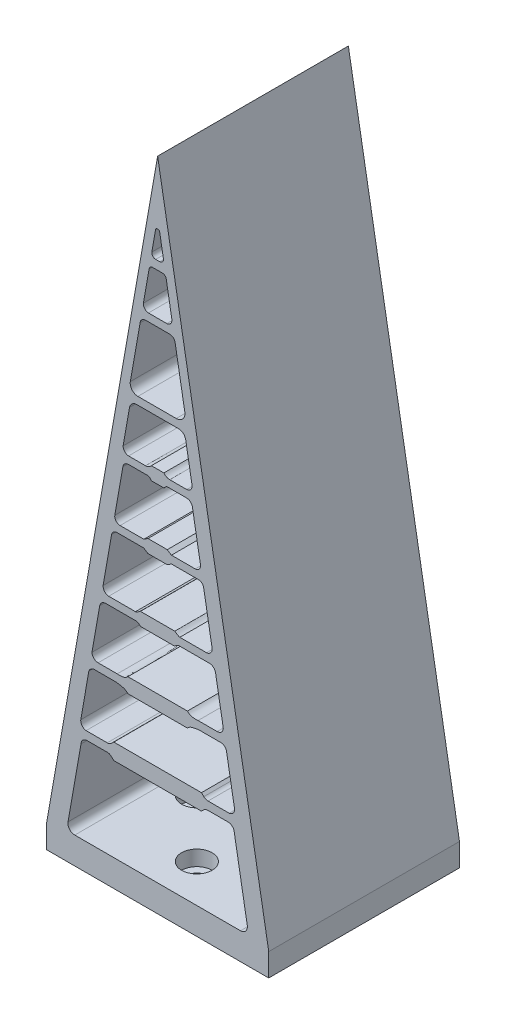
from build123d import *

# Parameters (mm, degrees)
BOSS_EXTRUDE1_DEPTH = 25
CUT_EXTRUDE1_REACH  = 92.769
SKETCH4_R           = 1
CUT_EXTRUDE2_START  = -2
SKETCH5_R           = 2
SKETCH5_R_2         = 1
CUT_EXTRUDE2_DEPTH  = 2


with BuildPart() as part:
    # Sketch2 → Boss-Extrude1 (new body)
    with BuildSketch(Plane.XY):
        Polygon((14.422152343, -46.919584995), (-0.139795688, 36.091209392), (-14.701743719, -46.919584995), (-14.701743719, -49.919584995), (14.422152343, -49.919584995), align=None)
        with BuildLine():
            Line((-1.40400653, -9.655975895), (-0.139795688, -9.655975895))
            Line((-0.139795688, -9.655975895), (1.124415155, -9.655975895))
            Line((1.124415155, -9.655975895), (1.668587786, -9.300465842))
            Line((1.668587786, -9.300465842), (5.204485199, -9.300465842))
            ThreePointArc((5.204485199, -9.300465842), (5.654671752, -9.464432199), (5.893957023, -9.87951708))
            Line((5.893957023, -9.87951708), (7.006215614, -16.219978464))
            ThreePointArc((7.006215614, -16.219978464), (6.818344291, -16.796821256), (6.277609756, -17.07186562))
            Line((6.277609756, -17.07186562), (2.763006949, -17.07186562))
            add(Edge.make_bspline(
                [(2.111160568, -16.708002848), (2.102252973, -16.627378866), (2.349572053, -16.972792726), (2.763006949, -17.07186562)],
                knots=[0, 0, 0, 0, 1, 1, 1, 1], degree=3))
            Line((2.111160568, -16.708002848), (-0.139795688, -16.708002848))
            Line((-0.139795688, -16.708002848), (-2.390751943, -16.708002848))
            add(Edge.make_bspline(
                [(-2.390751943, -16.708002848), (-2.381844348, -16.627378866), (-2.629163428, -16.972792726), (-3.042598325, -17.07186562)],
                knots=[0, 0, 0, 0, 1, 1, 1, 1], degree=3))
            Line((-3.042598325, -17.07186562), (-6.557201131, -17.07186562))
            ThreePointArc((-6.557201131, -17.07186562), (-7.097935667, -16.796821256), (-7.285806989, -16.219978464))
            Line((-7.285806989, -16.219978464), (-6.173548399, -9.87951708))
            ThreePointArc((-6.173548399, -9.87951708), (-5.934263128, -9.464432199), (-5.484076574, -9.300465842))
            Line((-5.484076574, -9.300465842), (-1.948179161, -9.300465842))
            Line((-1.948179161, -9.300465842), (-1.40400653, -9.655975895))
        make_face(mode=Mode.SUBTRACT)
        with BuildLine():
            Line((-5.881614418, -35.391027806), (-0.139795688, -35.391027806))
            Line((-0.139795688, -35.391027806), (5.602023043, -35.391027806))
            Line((5.602023043, -35.391027806), (5.915498941, -35.09635726))
            ThreePointArc((5.915498941, -35.09635726), (6.16778475, -34.926695384), (6.467542836, -34.875917716))
            Line((6.467542836, -34.875917716), (9.098026574, -34.875917716))
            ThreePointArc((9.098026574, -34.875917716), (9.660370794, -35.102679256), (9.908110966, -35.656101902))
            Line((9.908110966, -35.656101902), (11.608903489, -45.351517523))
            ThreePointArc((11.608903489, -45.351517523), (11.411625827, -46.085834358), (10.722439714, -46.407023075))
            Line((10.722439714, -46.407023075), (-0.139795688, -46.407023075))
            Line((-0.139795688, -46.407023075), (-11.002031089, -46.407023075))
            ThreePointArc((-11.002031089, -46.407023075), (-11.691217203, -46.085834358), (-11.888494864, -45.351517523))
            Line((-11.888494864, -45.351517523), (-10.187702341, -35.656101902))
            ThreePointArc((-10.187702341, -35.656101902), (-9.939962169, -35.102679256), (-9.37761795, -34.875917716))
            Line((-9.37761795, -34.875917716), (-6.747134212, -34.875917716))
            ThreePointArc((-6.747134212, -34.875917716), (-6.447376125, -34.926695384), (-6.195090316, -35.09635726))
            Line((-6.195090316, -35.09635726), (-5.881614418, -35.391027806))
        make_face(mode=Mode.SUBTRACT)
        with BuildLine():
            Line((-4.026574464, -26.882064641), (-0.139795688, -26.882064641))
            Line((-0.139795688, -26.882064641), (3.746983088, -26.882064641))
            add(Edge.make_bspline(
                [(3.746983088, -26.882064641), (3.982195465, -26.700138412), (4.018694606, -26.480042162), (5.313455202, -26.331359996)],
                knots=[0, 0, 0, 0, 1, 1, 1, 1], degree=3))
            Line((5.313455202, -26.331359996), (8.256755855, -26.331359996))
            ThreePointArc((8.256755855, -26.331359996), (8.638933457, -26.519249666), (8.875104179, -26.873630304))
            Line((8.875104179, -26.873630304), (9.935345034, -32.917563119))
            ThreePointArc((9.935345034, -32.917563119), (9.772361548, -33.506379767), (9.240757676, -33.807487694))
            Line((9.240757676, -33.807487694), (6.467542836, -33.807487694))
            ThreePointArc((6.467542836, -33.807487694), (6.16778475, -33.756710027), (5.915498941, -33.58704815))
            Line((5.915498941, -33.58704815), (5.602023043, -33.292377604))
            Line((5.602023043, -33.292377604), (-0.139795688, -33.292377604))
            Line((-0.139795688, -33.292377604), (-5.881614418, -33.292377604))
            Line((-5.881614418, -33.292377604), (-6.195090316, -33.58704815))
            ThreePointArc((-6.195090316, -33.58704815), (-6.447376125, -33.756710027), (-6.747134212, -33.807487694))
            Line((-6.747134212, -33.807487694), (-9.520349051, -33.807487694))
            ThreePointArc((-9.520349051, -33.807487694), (-10.051952923, -33.506379767), (-10.214936409, -32.917563119))
            Line((-10.214936409, -32.917563119), (-9.154695555, -26.873630304))
            ThreePointArc((-9.154695555, -26.873630304), (-8.918524832, -26.519249666), (-8.53634723, -26.331359996))
            Line((-8.53634723, -26.331359996), (-5.593046577, -26.331359996))
            add(Edge.make_bspline(
                [(-4.026574464, -26.882064641), (-4.26178684, -26.700138412), (-4.298285981, -26.480042162), (-5.593046577, -26.331359996)],
                knots=[0, 0, 0, 0, 1, 1, 1, 1], degree=3))
        make_face(mode=Mode.SUBTRACT)
        with BuildLine():
            Line((-2.390751943, -18.418428407), (-0.139795688, -18.418428407))
            Line((-0.139795688, -18.418428407), (2.111160568, -18.418428407))
            add(Edge.make_bspline(
                [(2.111160568, -18.418428407), (2.141080572, -18.390479425), (2.396095932, -18.05922236), (2.763006949, -18.080801157)],
                knots=[0, 0, 0, 0, 1, 1, 1, 1], degree=3))
            Line((2.763006949, -18.080801157), (6.701912748, -18.080801157))
            ThreePointArc((6.701912748, -18.080801157), (7.188440024, -18.284395061), (7.448818359, -18.743047861))
            Line((7.448818359, -18.743047861), (8.464574682, -24.533395358))
            ThreePointArc((8.464574682, -24.533395358), (8.226773089, -25.092599736), (7.664637434, -25.323386736))
            Line((7.664637434, -25.323386736), (5.156289374, -25.323386736))
            add(Edge.make_bspline(
                [(3.762050815, -24.947567838), (3.958534995, -25.129434807), (4.149792228, -25.399832964), (5.156289374, -25.323386736)],
                knots=[0, 0, 0, 0, 1, 1, 1, 1], degree=3))
            Line((3.762050815, -24.947567838), (-0.139795688, -24.947567838))
            Line((-0.139795688, -24.947567838), (-4.04164219, -24.947567838))
            add(Edge.make_bspline(
                [(-4.04164219, -24.947567838), (-4.23812637, -25.129434807), (-4.429383603, -25.399832964), (-5.435880749, -25.323386736)],
                knots=[0, 0, 0, 0, 1, 1, 1, 1], degree=3))
            Line((-5.435880749, -25.323386736), (-7.944228809, -25.323386736))
            ThreePointArc((-7.944228809, -25.323386736), (-8.506364465, -25.092599736), (-8.744166058, -24.533395358))
            Line((-8.744166058, -24.533395358), (-7.728409734, -18.743047861))
            ThreePointArc((-7.728409734, -18.743047861), (-7.468031399, -18.284395061), (-6.981504123, -18.080801157))
            Line((-6.981504123, -18.080801157), (-3.042598325, -18.080801157))
            add(Edge.make_bspline(
                [(-2.390751943, -18.418428407), (-2.420671947, -18.390479425), (-2.675687307, -18.05922236), (-3.042598325, -18.080801157)],
                knots=[0, 0, 0, 0, 1, 1, 1, 1], degree=3))
        make_face(mode=Mode.SUBTRACT)
        with BuildLine():
            Line((2.295557974, 7.526297276), (-0.139795688, 7.526297276))
            Line((-0.139795688, 7.526297276), (-2.729443291, 7.526297276))
            ThreePointArc((-2.729443291, 7.526297276), (-3.501604827, 7.886155909), (-3.722633979, 8.708881738))
            Line((-3.722633979, 8.708881738), (-2.442643211, 16.005505118))
            ThreePointArc((-2.442643211, 16.005505118), (-2.186978691, 16.505082884), (-1.652941749, 16.677555594))
            Line((-1.652941749, 16.677555594), (-0.139795688, 16.677555594))
            Line((-0.139795688, 16.677555594), (1.373350374, 16.677555594))
            ThreePointArc((1.373350374, 16.677555594), (1.907387315, 16.505082884), (2.163051835, 16.005505118))
            Line((2.163051835, 16.005505118), (3.443042604, 8.708881738))
            ThreePointArc((3.443042604, 8.708881738), (3.119455265, 7.874859283), (2.295557974, 7.526297276))
        make_face(mode=Mode.SUBTRACT)
        with BuildLine():
            Line((-0.960175082, -1.168175869), (-0.139795688, -1.168175869))
            Line((-0.139795688, -1.168175869), (0.680583707, -1.168175869))
            add(Edge.make_bspline(
                [(0.680583707, -1.168175869), (0.780839874, -1.061394631), (0.918172753, -0.790932941), (1.263062379, -0.813949097)],
                knots=[0, 0, 0, 0, 1, 1, 1, 1], degree=3))
            Line((1.263062379, -0.813949097), (3.668573853, -0.813949097))
            ThreePointArc((3.668573853, -0.813949097), (4.154894201, -0.991076057), (4.413385477, -1.439477331))
            Line((4.413385477, -1.439477331), (5.472943401, -7.47951708))
            ThreePointArc((5.472943401, -7.47951708), (5.31950522, -8.050652396), (4.783471576, -8.300465842))
            Line((4.783471576, -8.300465842), (1.668587786, -8.300465842))
            Line((1.668587786, -8.300465842), (1.124415155, -7.944955789))
            Line((1.124415155, -7.944955789), (-0.139795688, -7.944955789))
            Line((-0.139795688, -7.944955789), (-1.40400653, -7.944955789))
            Line((-1.40400653, -7.944955789), (-1.948179161, -8.300465842))
            Line((-1.948179161, -8.300465842), (-5.063062951, -8.300465842))
            ThreePointArc((-5.063062951, -8.300465842), (-5.599096595, -8.050652396), (-5.752534776, -7.47951708))
            Line((-5.752534776, -7.47951708), (-4.692976852, -1.439477331))
            ThreePointArc((-4.692976852, -1.439477331), (-4.434485577, -0.991076057), (-3.948165228, -0.813949097))
            Line((-3.948165228, -0.813949097), (-1.542653755, -0.813949097))
            add(Edge.make_bspline(
                [(-0.960175082, -1.168175869), (-1.060431249, -1.061394631), (-1.197764128, -0.790932941), (-1.542653755, -0.813949097)],
                knots=[0, 0, 0, 0, 1, 1, 1, 1], degree=3))
        make_face(mode=Mode.SUBTRACT)
        with BuildLine():
            Line((-4.659377612, 0.944060058), (-3.820763657, 5.724602499))
            ThreePointArc((-3.820763657, 5.724602499), (-3.489473886, 6.299286325), (-2.866191894, 6.526297276))
            Line((-2.866191894, 6.526297276), (-0.139795688, 6.526297276))
            Line((-0.139795688, 6.526297276), (-0.12702464, 6.526297276))
            Line((-0.12702464, 6.526297276), (2.731649129, 6.526297276))
            ThreePointArc((2.731649129, 6.526297276), (3.264062496, 6.25434817), (3.541172282, 5.724602499))
            Line((3.541172282, 5.724602499), (4.379786237, 0.944060058))
            ThreePointArc((4.379786237, 0.944060058), (4.190347888, 0.403391978), (3.674551608, 0.154066772))
            Line((3.674551608, 0.154066772), (1.446159281, 0.154066772))
            add(Edge.make_bspline(
                [(0.680583707, 0.541594227), (0.70301896, 0.521510302), (0.957263814, 0.149921668), (1.446159281, 0.154066772)],
                knots=[0, 0, 0, 0, 1, 1, 1, 1], degree=3))
            Line((0.680583707, 0.541594227), (-0.139795688, 0.541594227))
            Line((-0.139795688, 0.541594227), (-0.960175082, 0.541594227))
            add(Edge.make_bspline(
                [(-0.960175082, 0.541594227), (-0.982610335, 0.521510302), (-1.236855189, 0.149921668), (-1.725750656, 0.154066772)],
                knots=[0, 0, 0, 0, 1, 1, 1, 1], degree=3))
            Line((-1.725750656, 0.154066772), (-3.954142983, 0.154066772))
            ThreePointArc((-3.954142983, 0.154066772), (-4.469939263, 0.403391978), (-4.659377612, 0.944060058))
        make_face(mode=Mode.SUBTRACT)
        with BuildLine():
            Line((1.069108247, 17.685824003), (-0.139795688, 17.685824003))
            Line((-0.139795688, 17.685824003), (-1.348699622, 17.685824003))
            ThreePointArc((-1.348699622, 17.685824003), (-1.841673607, 17.938808604), (-2.01094404, 18.466418383))
            Line((-2.01094404, 18.466418383), (-1.264950242, 22.718977013))
            ThreePointArc((-1.264950242, 22.718977013), (-1.094032192, 23.015466214), (-0.772470368, 23.13258504))
            Line((-0.772470368, 23.13258504), (-0.139795688, 23.13258504))
            Line((-0.139795688, 23.13258504), (0.492878992, 23.13258504))
            ThreePointArc((0.492878992, 23.13258504), (0.814440816, 23.015466214), (0.985358867, 22.718977013))
            Line((0.985358867, 22.718977013), (1.731352665, 18.466418383))
            ThreePointArc((1.731352665, 18.466418383), (1.562082232, 17.938808604), (1.069108247, 17.685824003))
        make_face(mode=Mode.SUBTRACT)
        with BuildLine():
            Line((0.123228718, 24.239786827), (-0.139795688, 24.239786827))
            Line((-0.139795688, 24.239786827), (-0.402820093, 24.239786827))
            ThreePointArc((-0.402820093, 24.239786827), (-0.785701267, 24.418225003), (-0.895299968, 24.826178801))
            Line((-0.895299968, 24.826178801), (-0.401243915, 27.642559228))
            ThreePointArc((-0.401243915, 27.642559228), (-0.332876695, 27.761154909), (-0.204251965, 27.808002439))
            Line((-0.204251965, 27.808002439), (-0.139795688, 27.808002439))
            Line((-0.139795688, 27.808002439), (-0.07533941, 27.808002439))
            ThreePointArc((-0.07533941, 27.808002439), (0.05328532, 27.761154909), (0.12165254, 27.642559228))
            Line((0.12165254, 27.642559228), (0.615708593, 24.826178801))
            ThreePointArc((0.615708593, 24.826178801), (0.506109892, 24.418225003), (0.123228718, 24.239786827))
        make_face(mode=Mode.SUBTRACT)
    extrude(amount=BOSS_EXTRUDE1_DEPTH)

    # Sketch4 → Cut-Extrude1 (cut, up to next)
    with BuildSketch(Plane.XZ.offset(49.919584995), mode=Mode.PRIVATE) as cut_extrude1_sk1:
        with Locations(Location((0, 5, 0), (0, 0, 270))):
            Circle(SKETCH4_R)
    cut_extrude1_tool1 = extrude(cut_extrude1_sk1.sketch, amount=-CUT_EXTRUDE1_REACH, mode=Mode.PRIVATE) & part.part
    # Sketch4 → Cut-Extrude1 (cut, up to next)
    with BuildSketch(Plane.XZ.offset(49.919584995), mode=Mode.PRIVATE) as cut_extrude1_sk2:
        with Locations(Location((-7.5, 12.5, 0), (0, 0, 270))):
            Circle(SKETCH4_R)
    cut_extrude1_tool2 = extrude(cut_extrude1_sk2.sketch, amount=-CUT_EXTRUDE1_REACH, mode=Mode.PRIVATE) & part.part
    # Sketch4 → Cut-Extrude1 (cut, up to next)
    with BuildSketch(Plane.XZ.offset(49.919584995), mode=Mode.PRIVATE) as cut_extrude1_sk3:
        with Locations(Location((0, 20, 0), (0, 0, 270))):
            Circle(SKETCH4_R)
    cut_extrude1_tool3 = extrude(cut_extrude1_sk3.sketch, amount=-CUT_EXTRUDE1_REACH, mode=Mode.PRIVATE) & part.part
    # Sketch4 → Cut-Extrude1 (cut, up to next)
    with BuildSketch(Plane.XZ.offset(49.919584995), mode=Mode.PRIVATE) as cut_extrude1_sk4:
        with Locations(Location((7.5, 12.5, 0), (0, 0, 270))):
            Circle(SKETCH4_R)
    cut_extrude1_tool4 = extrude(cut_extrude1_sk4.sketch, amount=-CUT_EXTRUDE1_REACH, mode=Mode.PRIVATE) & part.part
    add(cut_extrude1_tool1.solids().sort_by_distance((0, -49.919585, 5))[0], mode=Mode.SUBTRACT)
    add(cut_extrude1_tool2.solids().sort_by_distance((-7.5, -49.919585, 12.5))[0], mode=Mode.SUBTRACT)
    add(cut_extrude1_tool3.solids().sort_by_distance((0, -49.919585, 20))[0], mode=Mode.SUBTRACT)
    add(cut_extrude1_tool4.solids().sort_by_distance((7.5, -49.919585, 12.5))[0], mode=Mode.SUBTRACT)

    # Sketch5 → Cut-Extrude2 (cut)
    # profile 1 of 4: a face of its own
    with BuildSketch(Plane(origin=(0, -46.407023075, 0), x_dir=(1, 0, 0), z_dir=(0, 1, 0)).offset(CUT_EXTRUDE2_START)):
        with Locations(Location((0, -20, 0), (0, 0, 270))):
            Circle(SKETCH5_R)
        with Locations(Location((0, -20, 0), (0, 0, 90))):
            Circle(SKETCH5_R_2, mode=Mode.SUBTRACT)
    # profile 2 of 4: a face of its own
    with BuildSketch(Plane(origin=(0, -46.407023075, 0), x_dir=(1, 0, 0), z_dir=(0, 1, 0)).offset(CUT_EXTRUDE2_START)):
        with Locations(Location((0, -5, 0), (0, 0, 270))):
            Circle(SKETCH5_R)
        with Locations(Location((0, -5, 0), (0, 0, 90))):
            Circle(SKETCH5_R_2, mode=Mode.SUBTRACT)
    # profile 3 of 4: a face of its own
    with BuildSketch(Plane(origin=(0, -46.407023075, 0), x_dir=(1, 0, 0), z_dir=(0, 1, 0)).offset(CUT_EXTRUDE2_START)):
        with Locations(Location((-7.5, -12.5, 0), (0, 0, 270))):
            Circle(SKETCH5_R)
        with Locations(Location((-7.5, -12.5, 0), (0, 0, 90))):
            Circle(SKETCH5_R_2, mode=Mode.SUBTRACT)
    # profile 4 of 4: a face of its own
    with BuildSketch(Plane(origin=(0, -46.407023075, 0), x_dir=(1, 0, 0), z_dir=(0, 1, 0)).offset(CUT_EXTRUDE2_START)):
        with Locations(Location((7.5, -12.5, 0), (0, 0, 270))):
            Circle(SKETCH5_R)
        with Locations(Location((7.5, -12.5, 0), (0, 0, 90))):
            Circle(SKETCH5_R_2, mode=Mode.SUBTRACT)
    extrude(amount=CUT_EXTRUDE2_DEPTH, mode=Mode.SUBTRACT)


solid = part.part
